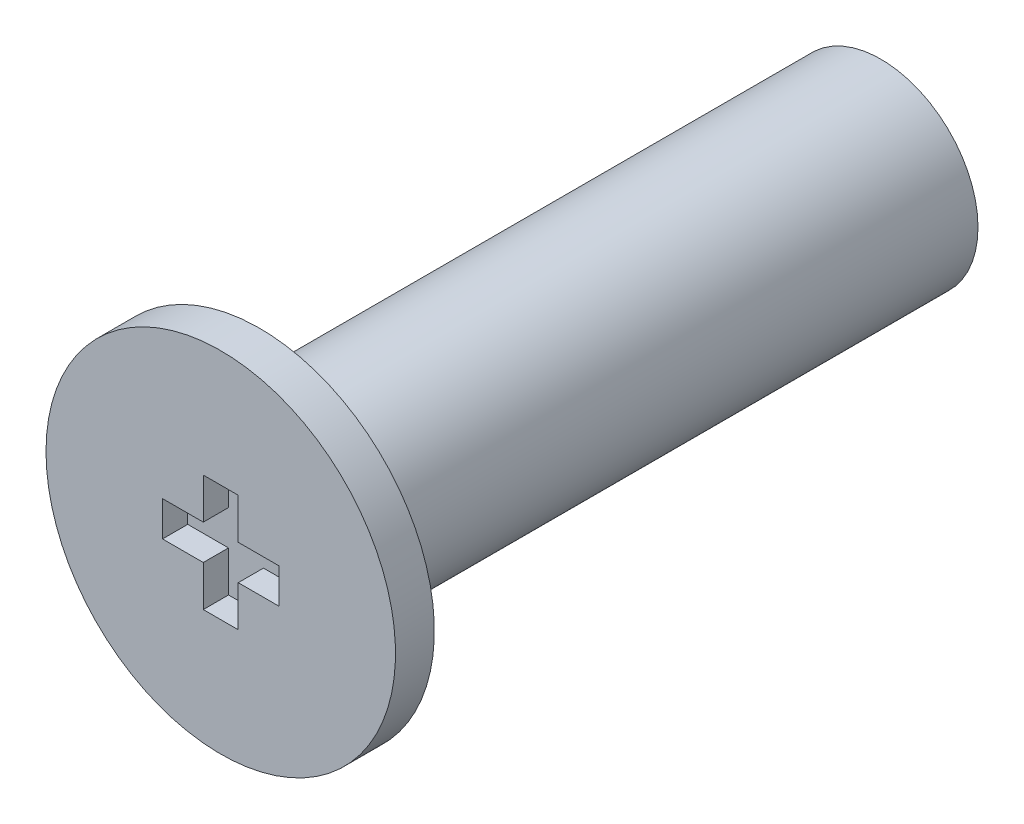
from build123d import *

# Parameters (mm, degrees)
SKETCH_1_R        = 2.5
EXTRUDE_198_DEPTH = 16
SKETCH_6_W        = 4.5
SKETCH_6_H        = 1
PH2_START         = 1.01
PH2_DEPTH         = 0.66


with BuildPart() as part:
    # 草图1 → Extrude 198 (new body)
    with BuildSketch(Plane.XY):
        Circle(SKETCH_1_R)
    extrude(amount=-EXTRUDE_198_DEPTH)

    # 草图6 → Revolve 324 (revolve)
    with BuildSketch(Plane(origin=(0, 0, 0), x_dir=(1, 0, 0), z_dir=(0, 1, 0)), mode=Mode.PRIVATE) as revolve_324_sk:
        with Locations((2.25, -0.5)):
            Rectangle(SKETCH_6_W, SKETCH_6_H)
    revolve(revolve_324_sk.sketch.rotate(Axis((0, 0, -2), (0, 0, 1)), 180), axis=Axis((0, 0, -2), (0, 0, 1)))

    # 草图7 → 十字槽_PH2_简化 (cut)
    with BuildSketch(Plane.XY.offset(PH2_START)):
        Polygon((-0.45, -1.5), (0.45, -1.5), (0.45, -0.45), (1.5, -0.45), (1.5, 0.45), (0.45, 0.45), (0.45, 1.5), (-0.45, 1.5), (-0.45, 0.45), (-1.5, 0.45), (-1.5, -0.45), (-0.45, -0.45), align=None)
    extrude(amount=-PH2_DEPTH, mode=Mode.SUBTRACT)


solid = part.part
